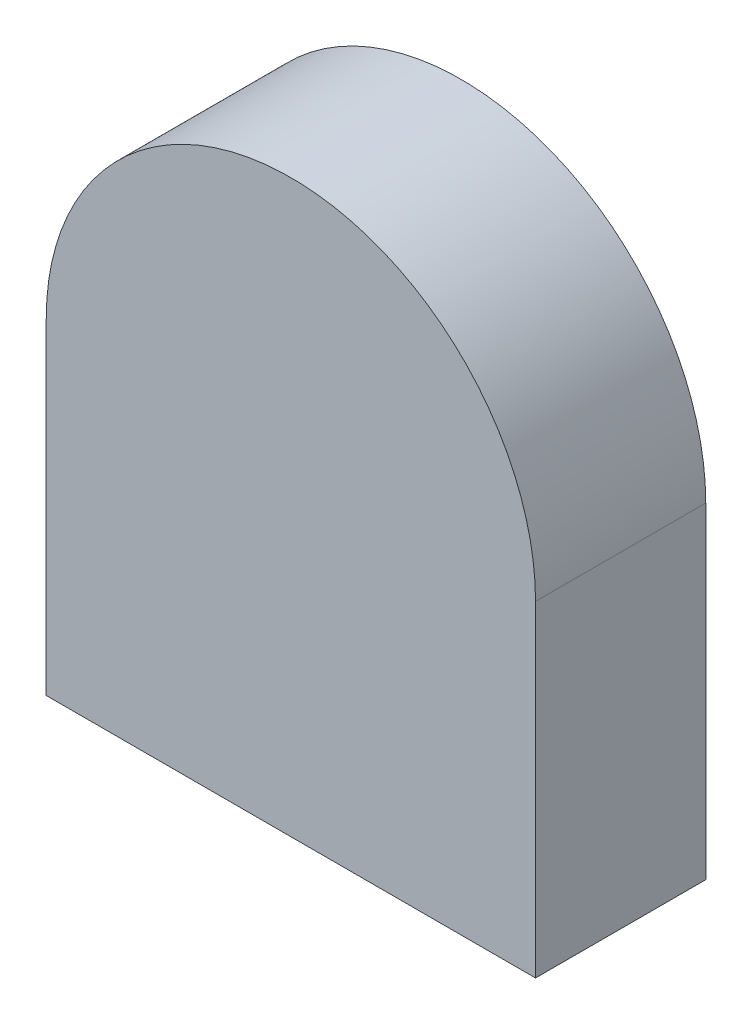
from build123d import *

# Parameters (mm, degrees)
SKETCH1_R           = 8.5
BOSS_EXTRUDE1_DEPTH = 1
BOSS_EXTRUDE2_START = -7.35
BOSS_EXTRUDE2_DEPTH = 7.35


with BuildPart() as part:
    # Sketch1 → Boss-Extrude1 (new body)
    # profile 1 of 3: a face of its own
    with BuildSketch(Plane.XY.offset(55.098344014)):
        with BuildLine():
            Line((37.502628192, 13.761312554), (37.502628192, 29.761312554))
            ThreePointArc((37.502628192, 29.761312554), (25.502628192, 41.761312554), (13.502628192, 29.761312554))
            Line((13.502628192, 29.761312554), (13.502628192, 13.761312554))
            Line((13.502628192, 13.761312554), (37.502628192, 13.761312554))
        make_face()
        with BuildLine():
            ThreePointArc((35.502628192, 29.761312554), (25.502628192, 39.761312554), (15.502628192, 29.761312554))
            Line((15.502628192, 29.761312554), (15.502628192, 15.761312554))
            Line((15.502628192, 15.761312554), (35.502628192, 15.761312554))
            Line((35.502628192, 15.761312554), (35.502628192, 29.761312554))
        make_face(mode=Mode.SUBTRACT)
    # profile 2 of 3: a face of its own
    with BuildSketch(Plane.XY.offset(55.098344014)):
        with BuildLine():
            Line((35.502628192, 15.761312554), (35.502628192, 29.761312554))
            ThreePointArc((35.502628192, 29.761312554), (25.502628192, 39.761312554), (15.502628192, 29.761312554))
            Line((15.502628192, 29.761312554), (15.502628192, 15.761312554))
            Line((15.502628192, 15.761312554), (35.502628192, 15.761312554))
        make_face()
        with Locations((25.502628192, 29.761312554)):
            Circle(SKETCH1_R, mode=Mode.SUBTRACT)
    # profile 3 of 3: a face of its own
    with BuildSketch(Plane.XY.offset(55.098344014)):
        with Locations((25.502628192, 29.761312554)):
            Circle(SKETCH1_R)
    extrude(amount=BOSS_EXTRUDE1_DEPTH)

    # Sketch1<4> → Boss-Extrude2 (add)
    with BuildSketch(Plane.XY.offset(55.098344014).offset(BOSS_EXTRUDE2_START)):
        with BuildLine():
            Line((13.502628192, 29.761312554), (13.502628192, 13.761312554))
            Line((13.502628192, 13.761312554), (37.502628192, 13.761312554))
            Line((37.502628192, 13.761312554), (37.502628192, 29.761312554))
            ThreePointArc((37.502628192, 29.761312554), (25.502628192, 41.761312554), (13.502628192, 29.761312554))
        make_face()
        with BuildLine():
            Line((15.502628192, 29.761312554), (15.502628192, 15.761312554))
            Line((15.502628192, 15.761312554), (35.502628192, 15.761312554))
            Line((35.502628192, 15.761312554), (35.502628192, 29.761312554))
            ThreePointArc((35.502628192, 29.761312554), (25.502628192, 39.761312554), (15.502628192, 29.761312554))
        make_face(mode=Mode.SUBTRACT)
    extrude(amount=BOSS_EXTRUDE2_DEPTH)


solid = part.part
